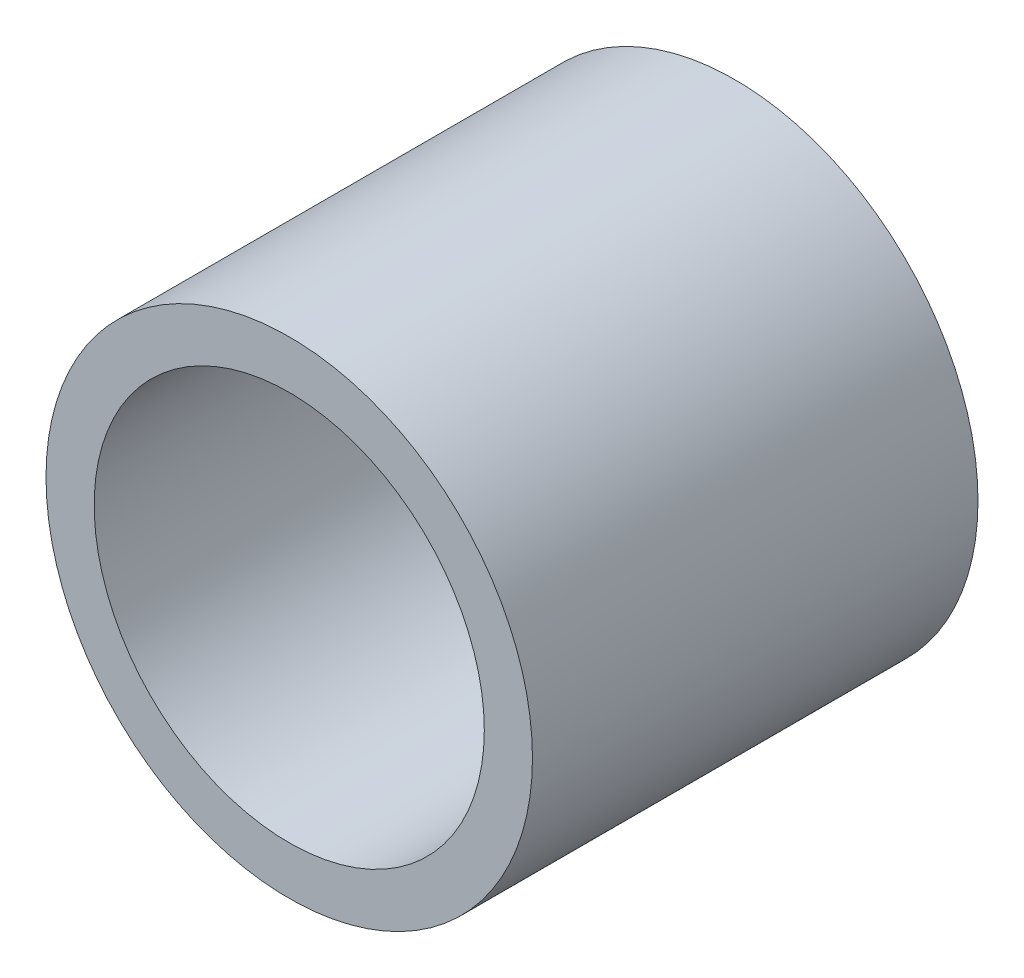
from build123d import *

# Parameters (mm, degrees)
SKETCH1_R           = 5.05
SKETCH1_R_2         = 4.05
EXTRUDE_THIN1_DEPTH = 9.25


with BuildPart() as part:
    # Sketch1 → Extrude-Thin1 (new body)
    with BuildSketch(Plane.XY):
        Circle(SKETCH1_R)
        Circle(SKETCH1_R_2, mode=Mode.SUBTRACT)
    extrude(amount=EXTRUDE_THIN1_DEPTH)


solid = part.part
